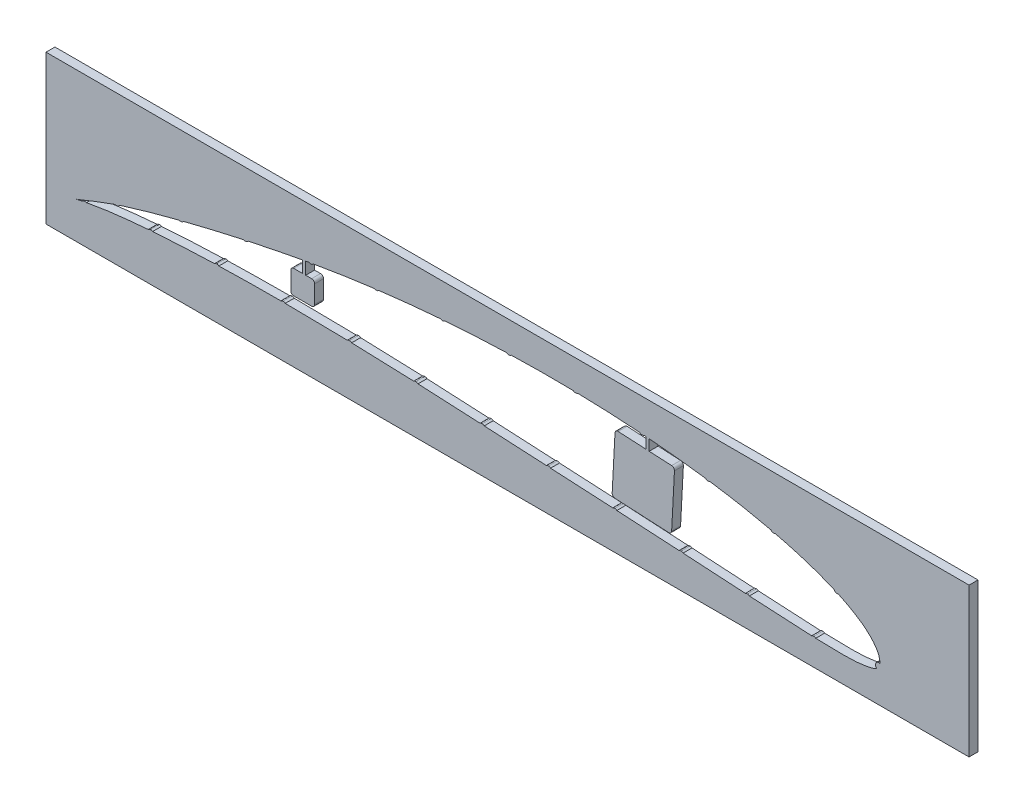
from build123d import *

# Parameters (mm, degrees)
SKETCH1_W           = 310
SKETCH1_H           = 50
BOSS_EXTRUDE1_DEPTH = 3
BOSS_EXTRUDE2_DEPTH = 3


with BuildPart() as part:
    # Sketch1 → Boss-Extrude1 (new body)
    with BuildSketch(Plane.XY):
        with Locations((-125.06174183, 12.712423786)):
            Rectangle(SKETCH1_W, SKETCH1_H)
        with BuildLine():
            Line((-190.854046013, 16.427278573), (-192.854046013, 16.427278573))
            Line((-192.854046013, 16.427278573), (-192.854046013, 20.54514466))
            add(Edge.make_bspline(
                [(-78.484522378, 26.652149662), (-81.251127261, 26.869634885), (-87.073414981, 27.26302757), (-96.025885422, 27.668047953), (-105.384918155, 27.886864858), (-114.898008488, 27.902696712), (-124.515804536, 27.706451524), (-134.190671536, 27.317931762), (-143.873797479, 26.720630751), (-153.514388277, 25.926027355), (-163.067203005, 24.949636107), (-172.485706502, 23.778880627), (-181.729078705, 22.446563535), (-188.496197907, 21.326847294), (-192.17762913, 20.66781533), (-192.854046013, 20.54514466)],
                knots=[1.647759632, 1.647759632, 1.647759632, 1.647759632, 1.66281273, 1.679411487, 1.69636694, 1.713589801, 1.731010056, 1.748544795, 1.766108786, 1.783630907, 1.801013171, 1.818193169, 1.835110052, 1.851667835, 1.855396799, 1.855396799, 1.855396799, 1.855396799], degree=3))
            Line((-78.484522378, 26.652149662), (-78.484522378, 22.972101896))
            Line((-78.484522378, 22.972101896), (-87.927242035, 23.466973864))
            ThreePointArc((-87.927242035, 23.466973864), (-88.648708598, 23.211489154), (-88.978207526, 22.520680285))
            Line((-88.978207526, 22.520680285), (-89.920254739, 4.54534866))
            ThreePointArc((-89.920254739, 4.54534866), (-89.66477003, 3.823882097), (-88.97396116, 3.494383169))
            Line((-88.97396116, 3.494383169), (-70.998629535, 2.552335956))
            ThreePointArc((-70.998629535, 2.552335956), (-70.277162972, 2.807820666), (-69.947664044, 3.498629535))
            Line((-69.947664044, 3.498629535), (-69.005616831, 21.47396116))
            ThreePointArc((-69.005616831, 21.47396116), (-69.261101541, 22.195427723), (-69.95191041, 22.524926651))
            Line((-69.95191041, 22.524926651), (-77.484522378, 22.919694117))
            Line((-77.484522378, 22.919694117), (-77.484522378, 26.572204531))
            add(Edge.make_bspline(
                [(-193.854046013, 20.362650577), (-195.775064558, 20.009909173), (-200.53741142, 19.104785804), (-208.019279368, 17.586839989), (-216.168249336, 15.817671132), (-223.918686457, 14.035986434), (-231.212223769, 12.266490942), (-237.993728291, 10.535115835), (-244.210175447, 8.86000319), (-249.810113571, 7.265271836), (-254.761430832, 5.754227714), (-259.022541081, 4.299422433), (-262.648403106, 2.919508457), (-265.493337403, 1.754738112), (-267.906768705, 0.800062229), (-268.932933558, 0.352495646), (-270.280471496, -0.080567148), (-268.860809828, 0.278822671), (-267.668480022, 0.489833575), (-264.748869214, 1.083641172), (-261.088929812, 1.667980045), (-256.238976815, 2.310371582), (-250.459331692, 2.918267219), (-243.743065142, 3.484691083), (-236.181287302, 3.97467364), (-227.838646738, 4.368141791), (-218.796298238, 4.649921554), (-209.136302534, 4.808551014), (-198.94497761, 4.83921239), (-188.310538638, 4.740747809), (-177.32201621, 4.516393994), (-166.072995783, 4.174175733), (-154.665861127, 3.704101734), (-143.201063086, 3.137782813), (-131.757912783, 2.542116383), (-120.393777003, 1.94386939), (-109.157898555, 1.367589163), (-98.110689784, 0.793603648), (-87.325082432, 0.209915111), (-76.878076189, -0.378270295), (-66.846774726, -0.96142336), (-57.305003865, -1.531721296), (-48.322523014, -2.071535165), (-39.965688156, -2.570181112), (-32.295387746, -3.004453917), (-25.368431611, -3.360900663), (-19.237427863, -3.615179778), (-13.940140176, -3.732291891), (-9.503770594, -3.670988449), (-5.900938941, -3.41461399), (-3.191596638, -2.861610206), (-1.170171151, -2.329008204), (0.014220637, -1.034555315), (0.028186054, 0.614855639), (-0.371136915, 2.38878086), (-1.478979381, 4.293083172), (-3.162430323, 6.261264624), (-5.472242964, 8.274548329), (-8.419068717, 10.259041262), (-11.975730704, 12.243103476), (-16.161330709, 14.167604478), (-20.956808743, 16.015791751), (-26.337844602, 17.793495066), (-32.285460779, 19.468254867), (-38.767317027, 21.03094444), (-45.75223324, 22.464443982), (-53.204283366, 23.7510727), (-61.083945503, 24.88718815), (-69.222973825, 25.839585804), (-74.735956271, 26.348793209), (-77.484522378, 26.572204531)],
                knots=[0.857234774, 0.857234774, 0.857234774, 0.857234774, 0.867829233, 0.883529135, 0.898644977, 0.913060925, 0.926666149, 0.939354581, 0.951026028, 0.961586441, 0.970943402, 0.979085416, 0.986060364, 0.991821214, 0.996214085, 0.999021075, 1, 1.000988678, 1.003950606, 1.008892929, 1.015820808, 1.024635018, 1.035203508, 1.047420673, 1.06116749, 1.076313586, 1.092720066, 1.110239434, 1.128718328, 1.148000656, 1.167925959, 1.188335797, 1.209046907, 1.229854233, 1.250600951, 1.271203147, 1.291583147, 1.311628914, 1.331208392, 1.350174108, 1.368387322, 1.385713984, 1.402024798, 1.417199794, 1.431125285, 1.443698357, 1.454822889, 1.46441268, 1.472428608, 1.478904988, 1.483926315, 1.487499338, 1.490013233, 1.492769992, 1.496008152, 1.499868297, 1.504543556, 1.510029863, 1.516427009, 1.523784407, 1.532099009, 1.541394321, 1.551648505, 1.562828637, 1.574901531, 1.587808503, 1.601500251, 1.615916545, 1.630987665, 1.645945774, 1.645945774, 1.645945774, 1.645945774], degree=3))
            Line((-193.854046013, 20.362650577), (-193.854046013, 16.427278573))
            Line((-193.854046013, 16.427278573), (-196.854046013, 16.427278573))
            ThreePointArc((-196.854046013, 16.427278573), (-197.561152794, 16.134385355), (-197.854046013, 15.427278573))
            Line((-197.854046013, 15.427278573), (-197.854046013, 9.427278573))
            ThreePointArc((-197.854046013, 9.427278573), (-197.561152794, 8.720171792), (-196.854046013, 8.427278573))
            Line((-196.854046013, 8.427278573), (-190.854046013, 8.427278573))
            ThreePointArc((-190.854046013, 8.427278573), (-190.146939231, 8.720171792), (-189.854046013, 9.427278573))
            Line((-189.854046013, 9.427278573), (-189.854046013, 15.427278573))
            ThreePointArc((-189.854046013, 15.427278573), (-190.146939231, 16.134385355), (-190.854046013, 16.427278573))
        make_face(mode=Mode.SUBTRACT)
    extrude(amount=BOSS_EXTRUDE1_DEPTH)

    # Sketch3 → Boss-Extrude2 (add)
    with BuildSketch(Plane.XY.offset(3)):
        with BuildLine():
            add(Edge.make_bspline(
                [(-267.793762898, 0.47434084), (-267.390184569, 0.551157346), (-266.937861366, 0.640531573), (-266.468076613, 0.732523454)],
                knots=[1.004098785, 1.004098785, 1.004098785, 1.004098785, 1.00662261, 1.00662261, 1.00662261, 1.00662261], degree=3))
            add(Edge.make_bspline(
                [(-266.468076613, 0.732523454), (-266.478840093, 0.737579212), (-266.558089384, 0.773578021), (-266.711434593, 0.827459912), (-266.940755908, 0.8496544), (-267.092205745, 0.827711349), (-267.169404391, 0.8165263)],
                knots=[4.868465908, 4.868465908, 4.868465908, 4.868465908, 5.023571471, 6.003525842, 6.98233563, 8, 8, 8, 8], degree=3))
            add(Edge.make_bspline(
                [(-267.169404391, 0.8165263), (-267.245256457, 0.797530584), (-267.394244651, 0.760219307), (-267.597057236, 0.652197292), (-267.724242813, 0.548239461), (-267.784693534, 0.484296393), (-267.793762906, 0.474340855)],
                knots=[0, 0, 0, 0, 1.018964881, 2.001445009, 2.97537636, 3.151369878, 3.151369878, 3.151369878, 3.151369878], degree=3))
        make_face()
        with BuildLine():
            add(Edge.make_bspline(
                [(-245.023955545, 3.619065333), (-245.101278068, 3.609497866), (-245.25407744, 3.590591305), (-245.467040718, 3.501915976), (-245.620876919, 3.401767636), (-245.700896803, 3.330757778), (-245.72395492, 3.308593067)],
                knots=[0, 0, 0, 0, 1.012815776, 2.001455852, 2.978964713, 3.395872817, 3.395872817, 3.395872817, 3.395872817], degree=3))
            add(Edge.make_bspline(
                [(-245.723954917, 3.308593059), (-245.243381938, 3.34699133), (-244.762718726, 3.384401488), (-244.282020378, 3.420861121)],
                knots=[1.04433834, 1.04433834, 1.04433834, 1.04433834, 1.046952468, 1.046952468, 1.046952468, 1.046952468], degree=3))
            add(Edge.make_bspline(
                [(-244.282020378, 3.42086112), (-244.308930616, 3.439511225), (-244.399897478, 3.49732505), (-244.567874863, 3.572679986), (-244.792114926, 3.626792939), (-244.945922061, 3.621666309), (-245.023955545, 3.619065333)],
                knots=[4.598240587, 4.598240587, 4.598240587, 4.598240587, 5.024581527, 6.00155117, 6.986094334, 8, 8, 8, 8], degree=3))
        make_face()
        with BuildLine():
            add(Edge.make_bspline(
                [(-255.359721414, 5.53183626), (-255.838491485, 5.374993967), (-256.316329294, 5.215676841), (-256.7934998, 5.053581901)],
                knots=[0.971696601, 0.971696601, 0.971696601, 0.971696601, 0.974432324, 0.974432324, 0.974432324, 0.974432324], degree=3))
            add(Edge.make_bspline(
                [(-256.7934998, 5.053581901), (-256.749823745, 5.034625842), (-256.635403496, 4.992494459), (-256.441215659, 4.957813802), (-256.21292918, 4.96109392), (-256.066209624, 5.00253306), (-255.991393854, 5.023663857)],
                knots=[4.403727713, 4.403727713, 4.403727713, 4.403727713, 5.028536856, 6.002664276, 6.981511295, 8, 8, 8, 8], degree=3))
            add(Edge.make_bspline(
                [(-255.991393854, 5.023663857), (-255.91927165, 5.051054782), (-255.776957192, 5.105103666), (-255.592038558, 5.238874738), (-255.455354732, 5.385159708), (-255.385442524, 5.488486224), (-255.359721414, 5.53183626)],
                knots=[0, 0, 0, 0, 1.009161318, 1.991318031, 2.963919563, 3.624554738, 3.624554738, 3.624554738, 3.624554738], degree=3))
        make_face()
        with BuildLine():
            add(Edge.make_bspline(
                [(-222.747114127, 4.780986188), (-222.824891728, 4.774977505), (-222.977324444, 4.763201364), (-223.194848818, 4.687135569), (-223.355215687, 4.592047239), (-223.441146032, 4.521885412), (-223.467342742, 4.498540326)],
                knots=[0, 0, 0, 0, 1.016117046, 1.99144072, 2.980674945, 3.438668867, 3.438668867, 3.438668867, 3.438668867], degree=3))
            add(Edge.make_bspline(
                [(-223.46734274, 4.498540319), (-222.980243182, 4.513806768), (-222.493125643, 4.528468294), (-222.005991475, 4.542539833)],
                knots=[1.08464095, 1.08464095, 1.08464095, 1.08464095, 1.087284453, 1.087284453, 1.087284453, 1.087284453], degree=3))
            add(Edge.make_bspline(
                [(-222.005991473, 4.54253984), (-222.034933517, 4.565524614), (-222.126392065, 4.6316989), (-222.294254047, 4.716248), (-222.516130475, 4.777410815), (-222.668699075, 4.779772409), (-222.747114127, 4.780986188)],
                knots=[4.538777728, 4.538777728, 4.538777728, 4.538777728, 5.021253167, 6.012496999, 6.978491293, 8, 8, 8, 8], degree=3))
        make_face()
        with BuildLine():
            add(Edge.make_bspline(
                [(-233.929945547, 11.568361966), (-234.410811339, 11.446245271), (-234.891517309, 11.323496699), (-235.372056491, 11.200092009)],
                knots=[0.931434005, 0.931434005, 0.931434005, 0.931434005, 0.934125206, 0.934125206, 0.934125206, 0.934125206], degree=3))
            add(Edge.make_bspline(
                [(-235.372056491, 11.200092009), (-235.335050993, 11.18211839), (-235.228329461, 11.136453299), (-235.042669743, 11.086099768), (-234.811818713, 11.073640251), (-234.660587884, 11.104611041), (-234.583576876, 11.120382242)],
                knots=[4.487628115, 4.487628115, 4.487628115, 4.487628115, 5.022708447, 5.995940444, 6.97947629, 8, 8, 8, 8], degree=3))
            add(Edge.make_bspline(
                [(-234.583576876, 11.120382242), (-234.509083118, 11.143197524), (-234.362719314, 11.188024521), (-234.167858574, 11.310470645), (-234.02627362, 11.441614449), (-233.953980395, 11.534080051), (-233.929945556, 11.568361977)],
                knots=[0, 0, 0, 0, 1.012744823, 1.989820203, 2.972059704, 3.517376857, 3.517376857, 3.517376857, 3.517376857], degree=3))
        make_face()
        with BuildLine():
            add(Edge.make_bspline(
                [(-200.440005643, 5.082888308), (-200.518070257, 5.078791089), (-200.670472831, 5.070792243), (-200.890089113, 5.004091604), (-201.052844639, 4.912657476), (-201.141750556, 4.845249392), (-201.169809362, 4.821976337)],
                knots=[0, 0, 0, 0, 1.020257774, 1.99181043, 2.972259712, 3.448713741, 3.448713741, 3.448713741, 3.448713741], degree=3))
            add(Edge.make_bspline(
                [(-201.169809361, 4.821976331), (-200.681955226, 4.821723352), (-200.194101339, 4.821038459), (-199.706248513, 4.819930467)],
                knots=[1.124963496, 1.124963496, 1.124963496, 1.124963496, 1.127609793, 1.127609793, 1.127609793, 1.127609793], degree=3))
            add(Edge.make_bspline(
                [(-199.706248511, 4.819930473), (-199.734836026, 4.844094211), (-199.824344963, 4.912797485), (-199.99061139, 5.000750461), (-200.209411191, 5.070098289), (-200.361897922, 5.07855603), (-200.440005643, 5.082888308)],
                knots=[4.53221387, 4.53221387, 4.53221387, 4.53221387, 5.021571255, 6.007323212, 6.979298455, 8, 8, 8, 8], degree=3))
        make_face()
        with BuildLine():
            add(Edge.make_bspline(
                [(-212.221115848, 16.670006776), (-212.707711775, 16.56441245), (-213.194186025, 16.458256935), (-213.680538792, 16.351547529)],
                knots=[0.891110453, 0.891110453, 0.891110453, 0.891110453, 0.893811356, 0.893811356, 0.893811356, 0.893811356], degree=3))
            add(Edge.make_bspline(
                [(-213.680538792, 16.351547529), (-213.644033487, 16.331597971), (-213.538733114, 16.281210173), (-213.352575734, 16.23101408), (-213.123054159, 16.205443019), (-212.970920786, 16.232236484), (-212.893377202, 16.245893325)],
                knots=[4.486145224, 4.486145224, 4.486145224, 4.486145224, 5.02598796, 6.000604059, 6.980892074, 8, 8, 8, 8], degree=3))
            add(Edge.make_bspline(
                [(-212.893377202, 16.245893325), (-212.817802933, 16.266661813), (-212.669705883, 16.307360213), (-212.467467289, 16.419940996), (-212.321640611, 16.547218953), (-212.246100292, 16.637149657), (-212.221115848, 16.670006776)],
                knots=[0, 0, 0, 0, 1.016905749, 1.992751556, 2.981924989, 3.518295554, 3.518295554, 3.518295554, 3.518295554], degree=3))
        make_face()
        with BuildLine():
            add(Edge.make_bspline(
                [(-178.132477236, 4.776871171), (-178.210725093, 4.774226807), (-178.363569747, 4.769061465), (-178.586543449, 4.711919716), (-178.749952355, 4.622802077), (-178.839186711, 4.557840097), (-178.866774155, 4.536021099)],
                knots=[0, 0, 0, 0, 1.022532339, 1.997353114, 2.979055603, 3.438781285, 3.438781285, 3.438781285, 3.438781285], degree=3))
            add(Edge.make_bspline(
                [(-178.866774154, 4.536021095), (-178.381769609, 4.524361273), (-177.894511356, 4.512323019), (-177.407261197, 4.499965432), (-177.40499983, 4.499908073)],
                knots=[1.165294356, 1.165294356, 1.165294356, 1.165294356, 1.167925959, 1.16793823, 1.16793823, 1.16793823, 1.16793823], degree=3))
            add(Edge.make_bspline(
                [(-177.404999828, 4.49990808), (-177.432667302, 4.524133376), (-177.5207516, 4.594369534), (-177.683618363, 4.688451771), (-177.902075531, 4.761858796), (-178.054634974, 4.771799172), (-178.132477236, 4.776871171)],
                knots=[4.53621722, 4.53621722, 4.53621722, 4.53621722, 5.016588222, 6.006730755, 6.982949963, 8, 8, 8, 8], degree=3))
        make_face()
        with BuildLine():
            add(Edge.make_bspline(
                [(-155.836828262, 4.00154749), (-155.915467408, 4.001895511), (-156.068975788, 4.002574869), (-156.290315365, 3.939922426), (-156.460362888, 3.860978819), (-156.551976544, 3.796534492), (-156.581085876, 3.773888242)],
                knots=[0, 0, 0, 0, 1.023444484, 1.997825661, 2.978931005, 3.460338685, 3.460338685, 3.460338685, 3.460338685], degree=3))
            add(Edge.make_bspline(
                [(-156.581085873, 3.773888232), (-156.094143326, 3.752510867), (-155.607212692, 3.730866238), (-155.120293937, 3.708965076)],
                knots=[1.205613891, 1.205613891, 1.205613891, 1.205613891, 1.208257794, 1.208257794, 1.208257794, 1.208257794], degree=3))
            add(Edge.make_bspline(
                [(-155.120293934, 3.708965083), (-155.146167781, 3.732513848), (-155.230792853, 3.803366073), (-155.389439283, 3.901676855), (-155.60647794, 3.979826963), (-155.759244034, 3.994231805), (-155.836828262, 4.00154749)],
                knots=[4.558911359, 4.558911359, 4.558911359, 4.558911359, 5.015852811, 5.999881644, 6.984214142, 8, 8, 8, 8], degree=3))
        make_face()
        with BuildLine():
            add(Edge.make_bspline(
                [(-133.558549949, 2.874865269), (-133.637173707, 2.876459349), (-133.790652048, 2.879571089), (-134.012956615, 2.820433819), (-134.176929887, 2.747445759), (-134.263643196, 2.69007374), (-134.28709691, 2.673185916)],
                knots=[0, 0, 0, 0, 1.023444484, 1.997825661, 2.978931005, 3.356421378, 3.356421378, 3.356421378, 3.356421378], degree=3))
            add(Edge.make_bspline(
                [(-134.287096906, 2.673185899), (-133.817491971, 2.648688123), (-133.34788861, 2.624160078), (-132.878286437, 2.59960907)],
                knots=[1.245973539, 1.245973539, 1.245973539, 1.245973539, 1.248524327, 1.248524327, 1.248524327, 1.248524327], degree=3))
            add(Edge.make_bspline(
                [(-132.878286434, 2.599609079), (-132.893903423, 2.613306858), (-132.967747207, 2.674818051), (-133.112799673, 2.767917926), (-133.328572728, 2.849497379), (-133.481091385, 2.866321117), (-133.558549949, 2.874865269)],
                knots=[4.744454359, 4.744454359, 4.744454359, 4.744454359, 5.015852811, 5.999881644, 6.984214142, 8, 8, 8, 8], degree=3))
        make_face()
        with BuildLine():
            add(Edge.make_bspline(
                [(-111.28636729, 1.718143076), (-111.364993141, 1.719630397), (-111.518475566, 1.72253374), (-111.74069963, 1.663094677), (-111.90546688, 1.589484988), (-111.992830014, 1.531316826), (-112.017005475, 1.513761561)],
                knots=[0, 0, 0, 0, 1.023444484, 1.997825661, 2.978931005, 3.369137804, 3.369137804, 3.369137804, 3.369137804], degree=3))
            add(Edge.make_bspline(
                [(-112.017005471, 1.513761545), (-111.545459671, 1.489467808), (-111.073914091, 1.465169653), (-110.602369117, 1.440859575)],
                knots=[1.286295342, 1.286295342, 1.286295342, 1.286295342, 1.288856585, 1.288856585, 1.288856585, 1.288856585], degree=3))
            add(Edge.make_bspline(
                [(-110.602369114, 1.440859583), (-110.619073756, 1.45557929), (-110.69403076, 1.51809021), (-110.840472211, 1.611801077), (-111.056355837, 1.693087475), (-111.208897197, 1.709704106), (-111.28636729, 1.718143076)],
                knots=[4.724973811, 4.724973811, 4.724973811, 4.724973811, 5.015852811, 5.999881644, 6.984214142, 8, 8, 8, 8], degree=3))
        make_face()
        with BuildLine():
            add(Edge.make_bspline(
                [(-89.013915983, 0.530722938), (-89.09253043, 0.532724238), (-89.245990594, 0.536630895), (-89.468598487, 0.478645872), (-89.629921484, 0.407836367), (-89.714446036, 0.353170664), (-89.735436554, 0.338506392)],
                knots=[0, 0, 0, 0, 1.023444484, 1.997825661, 2.978931005, 3.313464767, 3.313464767, 3.313464767, 3.313464767], degree=3))
            add(Edge.make_bspline(
                [(-89.735436549, 0.338506372), (-89.272612117, 0.313184626), (-88.809791252, 0.287797714), (-88.346973994, 0.262345318)],
                knots=[1.326639378, 1.326639378, 1.326639378, 1.326639378, 1.329153675, 1.329153675, 1.329153675, 1.329153675], degree=3))
            add(Edge.make_bspline(
                [(-88.346973991, 0.262345327), (-88.358712039, 0.2724794), (-88.428596911, 0.330500328), (-88.568725633, 0.421468214), (-88.784073243, 0.504164194), (-88.936502713, 0.521777695), (-89.013915983, 0.530722938)],
                knots=[4.813235575, 4.813235575, 4.813235575, 4.813235575, 5.015852811, 5.999881644, 6.984214142, 8, 8, 8, 8], degree=3))
        make_face()
        with BuildLine():
            add(Edge.make_bspline(
                [(-66.746335218, -0.750164769), (-66.824930618, -0.747519106), (-66.978353603, -0.742354612), (-67.201429341, -0.798512889), (-67.358760543, -0.866037565), (-67.439933886, -0.916702578), (-67.457122844, -0.928152382)],
                knots=[0, 0, 0, 0, 1.023444484, 1.997825661, 2.978931005, 3.248867788, 3.248867788, 3.248867788, 3.248867788], degree=3))
            add(Edge.make_bspline(
                [(-67.457122837, -0.9281524), (-67.199340042, -0.94332087), (-66.746976527, -0.969968184), (-66.294616023, -0.996666482), (-66.100036149, -1.008159588)],
                knots=[1.366986587, 1.366986587, 1.366986587, 1.366986587, 1.368387322, 1.36944464, 1.36944464, 1.36944464, 1.36944464], degree=3))
            add(Edge.make_bspline(
                [(-66.100036145, -1.008159577), (-66.105702389, -1.003386618), (-66.169470541, -0.950689024), (-66.302055427, -0.863065208), (-66.516717912, -0.778606725), (-66.668997877, -0.759744296), (-66.746335218, -0.750164769)],
                knots=[4.91905114, 4.91905114, 4.91905114, 4.91905114, 5.015852811, 5.999881644, 6.984214142, 8, 8, 8, 8], degree=3))
        make_face()
        with BuildLine():
            add(Edge.make_bspline(
                [(-44.4832946, -2.080833445), (-44.561886955, -2.078098808), (-44.715303995, -2.072760632), (-44.938443165, -2.128666337), (-45.095764593, -2.195976016), (-45.176923244, -2.246487525), (-45.194050488, -2.257861654)],
                knots=[0, 0, 0, 0, 1.023444484, 1.997825661, 2.978931005, 3.247650293, 3.247650293, 3.247650293, 3.247650293], degree=3))
            add(Edge.make_bspline(
                [(-45.194050481, -2.257861672), (-44.742247225, -2.284772574), (-44.290441054, -2.311633305), (-43.838631081, -2.338427529)],
                knots=[1.407312893, 1.407312893, 1.407312893, 1.407312893, 1.409767994, 1.409767994, 1.409767994, 1.409767994], degree=3))
            add(Edge.make_bspline(
                [(-43.838631076, -2.338427517), (-43.843851063, -2.33403364), (-43.907148118, -2.281685446), (-44.039142904, -2.194236766), (-44.25370964, -2.109535324), (-44.405968154, -2.090500517), (-44.4832946, -2.080833445)],
                knots=[4.92670192, 4.92670192, 4.92670192, 4.92670192, 5.015852811, 5.999881644, 6.984214142, 8, 8, 8, 8], degree=3))
        make_face()
        with BuildLine():
            add(Edge.make_bspline(
                [(-190.318477623, 20.997367187), (-190.486986248, 20.967831044), (-190.976874583, 20.881660246), (-191.466610664, 20.794632211), (-191.787844235, 20.737178636)],
                knots=[1.850739854, 1.850739854, 1.850739854, 1.850739854, 1.851667835, 1.853437965, 1.853437965, 1.853437965, 1.853437965], degree=3))
            add(Edge.make_bspline(
                [(-191.787844233, 20.737178656), (-191.75110527, 20.715038262), (-191.646745179, 20.659412297), (-191.462648394, 20.599272449), (-191.23524863, 20.569470388), (-191.083902094, 20.588390634), (-191.006662718, 20.59804654)],
                knots=[4.459855766, 4.459855766, 4.459855766, 4.459855766, 5.021260958, 6.007166681, 6.982961853, 8, 8, 8, 8], degree=3))
            add(Edge.make_bspline(
                [(-191.006662718, 20.59804654), (-190.930318899, 20.61502714), (-190.780989743, 20.648241337), (-190.578903107, 20.756584459), (-190.425238304, 20.87503224), (-190.345916547, 20.963306178), (-190.318477623, 20.997367187)],
                knots=[0, 0, 0, 0, 1.021170718, 1.997418549, 2.978274246, 3.550681198, 3.550681198, 3.550681198, 3.550681198], degree=3))
        make_face()
        with BuildLine():
            add(Edge.make_bspline(
                [(-22.217960077, -3.267214361), (-22.296252592, -3.267258917), (-22.449184476, -3.26734595), (-22.673932697, -3.317051975), (-22.827386101, -3.394243051), (-22.907802807, -3.446836651), (-22.925028119, -3.45870522)],
                knots=[0, 0, 0, 0, 1.022532339, 1.997353114, 2.979055603, 3.252421047, 3.252421047, 3.252421047, 3.252421047], degree=3))
            add(Edge.make_bspline(
                [(-22.925028116, -3.458705234), (-22.470796534, -3.47783912), (-22.016533038, -3.496298379), (-21.562228809, -3.513955533)],
                knots=[1.447637274, 1.447637274, 1.447637274, 1.447637274, 1.450103464, 1.450103464, 1.450103464, 1.450103464], degree=3))
            add(Edge.make_bspline(
                [(-21.562228806, -3.513955524), (-21.569421034, -3.508116073), (-21.636076656, -3.45532642), (-21.772284859, -3.370490101), (-21.988183948, -3.289869327), (-22.140329169, -3.274868444), (-22.217960077, -3.267214361)],
                knots=[4.895513355, 4.895513355, 4.895513355, 4.895513355, 5.016588222, 6.006730755, 6.982949963, 8, 8, 8, 8], degree=3))
        make_face()
        with BuildLine():
            add(Edge.make_bspline(
                [(-168.270728441, 24.294466836), (-168.763835662, 24.232804738), (-169.256843874, 24.170347218), (-169.749751981, 24.107107066)],
                knots=[1.810428026, 1.810428026, 1.810428026, 1.810428026, 1.813123617, 1.813123617, 1.813123617, 1.813123617], degree=3))
            add(Edge.make_bspline(
                [(-169.749751981, 24.107107067), (-169.713581462, 24.083518574), (-169.612010463, 24.024224631), (-169.433544387, 23.950414122), (-169.207713679, 23.913582598), (-169.055664117, 23.924574838), (-168.978111101, 23.93018144)],
                knots=[4.473176521, 4.473176521, 4.473176521, 4.473176521, 5.037763237, 6.009376168, 6.984680534, 8, 8, 8, 8], degree=3))
            add(Edge.make_bspline(
                [(-168.978111101, 23.93018144), (-168.90142057, 23.943621025), (-168.750802004, 23.970016085), (-168.5400325, 24.063376381), (-168.383910535, 24.179231882), (-168.299624339, 24.262752316), (-168.270728441, 24.294466836)],
                knots=[0, 0, 0, 0, 1.014535394, 1.992525864, 2.979250261, 3.539122721, 3.539122721, 3.539122721, 3.539122721], degree=3))
        make_face()
        with BuildLine():
            add(Edge.make_bspline(
                [(-1.094853393, -2.042457656), (-1.08558231, -2.049667895), (-1.076311226, -2.056878134), (-1.067023803, -2.064063616)],
                knots=[0, 0, 0, 0, 0.153518616, 0.153518616, 0.153518616, 0.153518616], degree=3))
            add(Edge.make_bspline(
                [(-1.067023803, -2.064063616), (-0.685162089, -1.798907567), (-0.117697015, -1.174942823), (-0.004967279, -0.387772907), (-0.000379941, -0.055533361)],
                knots=[1.487523627, 1.487523627, 1.487523627, 1.487523627, 1.490013233, 1.491780179, 1.491780179, 1.491780179, 1.491780179], degree=3))
            add(Edge.make_bspline(
                [(-0.000379941, -0.055533361), (-0.059965889, -0.037742992), (-0.197310888, -0.008626495), (-0.415852362, -0.00292606), (-0.644937168, -0.035502421), (-0.859530243, -0.11435627), (-1.053932486, -0.235110991), (-1.160099866, -0.344444625), (-1.21393711, -0.399887469)],
                knots=[2.162846994, 2.162846994, 2.162846994, 2.162846994, 2.978493865, 4.000928984, 5.021145435, 6.002338952, 6.986990499, 8, 8, 8, 8], degree=3))
            add(Edge.make_bspline(
                [(-1.21393711, -0.399887469), (-1.261664594, -0.461027892), (-1.355790986, -0.58160679), (-1.450563582, -0.790717018), (-1.496268485, -1.014932751), (-1.50024499, -1.245689039), (-1.46494958, -1.474662886), (-1.382438701, -1.687841235), (-1.262702971, -1.883772324), (-1.151461036, -1.988940676), (-1.094853393, -2.042457656)],
                knots=[0, 0, 0, 0, 1.015222514, 2.00218458, 2.980032379, 3.998510717, 5.016989055, 5.998983224, 6.981743319, 8, 8, 8, 8], degree=3))
        make_face()
        with BuildLine():
            add(Edge.make_bspline(
                [(-146.092116035, 26.522102622), (-146.586925954, 26.484111532), (-147.081676219, 26.445345161), (-147.576365037, 26.40580899)],
                knots=[1.770121259, 1.770121259, 1.770121259, 1.770121259, 1.772813161, 1.772813161, 1.772813161, 1.772813161], degree=3))
            add(Edge.make_bspline(
                [(-147.576365041, 26.405808978), (-147.543039593, 26.381581938), (-147.445925694, 26.318479283), (-147.269516843, 26.242651122), (-147.046249053, 26.187413881), (-146.892380716, 26.192444249), (-146.814316182, 26.194996387)],
                knots=[4.496582767, 4.496582767, 4.496582767, 4.496582767, 5.032459209, 6.002386309, 6.986518038, 8, 8, 8, 8], degree=3))
            add(Edge.make_bspline(
                [(-146.814316182, 26.194996387), (-146.736938005, 26.204386597), (-146.584028654, 26.222942875), (-146.371898581, 26.312109155), (-146.207965863, 26.41412722), (-146.121599508, 26.492371664), (-146.092116035, 26.522102622)],
                knots=[0, 0, 0, 0, 1.012612701, 2.00105455, 2.973405823, 3.518673912, 3.518673912, 3.518673912, 3.518673912], degree=3))
        make_face()
        with BuildLine():
            add(Edge.make_bspline(
                [(-14.812686334, 13.17526158), (-14.740365459, 13.146706291), (-14.598166893, 13.090560384), (-14.370991964, 13.064880071), (-14.154884887, 13.079059682), (-14.018350756, 13.115940369), (-13.955561017, 13.138548707)],
                knots=[0, 0, 0, 0, 1.017497944, 2.000622187, 2.973259471, 3.847854106, 3.847854106, 3.847854106, 3.847854106], degree=3))
            add(Edge.make_bspline(
                [(-13.955561017, 13.138548707), (-14.434793386, 13.360137844), (-14.91674589, 13.575888091), (-15.400965464, 13.786385381)],
                knots=[1.52802877, 1.52802877, 1.52802877, 1.52802877, 1.530892122, 1.530892122, 1.530892122, 1.530892122], degree=3))
            add(Edge.make_bspline(
                [(-15.400965463, 13.786385381), (-15.377356451, 13.727733701), (-15.317186048, 13.603859425), (-15.188309095, 13.43443135), (-15.018358957, 13.281249354), (-14.882315907, 13.21114328), (-14.812686334, 13.17526158)],
                knots=[4.199145723, 4.199145723, 4.199145723, 4.199145723, 5.026777775, 5.998786963, 6.975738864, 8, 8, 8, 8], degree=3))
        make_face()
        with BuildLine():
            add(Edge.make_bspline(
                [(-123.812632823, 27.695435417), (-124.039673855, 27.688885968), (-124.53605593, 27.674218137), (-125.032415047, 27.658795417), (-125.301741012, 27.650202982)],
                knots=[1.72977801, 1.72977801, 1.72977801, 1.72977801, 1.731010056, 1.732471699, 1.732471699, 1.732471699, 1.732471699], degree=3))
            add(Edge.make_bspline(
                [(-125.301741012, 27.650202982), (-125.269250638, 27.623641118), (-125.175215288, 27.554594777), (-125.00300949, 27.470305499), (-124.783511852, 27.404406212), (-124.63045942, 27.402483517), (-124.55195106, 27.40149727)],
                knots=[4.483341512, 4.483341512, 4.483341512, 4.483341512, 5.031293301, 6.006726805, 6.977549031, 8, 8, 8, 8], degree=3))
            add(Edge.make_bspline(
                [(-124.55195106, 27.40149727), (-124.474135136, 27.407351354), (-124.321627312, 27.418824501), (-124.104849371, 27.495271288), (-123.936313129, 27.591346244), (-123.844523125, 27.666403764), (-123.812632823, 27.695435417)],
                knots=[0, 0, 0, 0, 1.015044803, 1.98933928, 2.972010026, 3.534115274, 3.534115274, 3.534115274, 3.534115274], degree=3))
        make_face()
        with BuildLine():
            add(Edge.make_bspline(
                [(-35.951989192, 20.049317642), (-35.875013566, 20.034807268), (-35.725298217, 20.006585016), (-35.496383941, 20.022781756), (-35.304444038, 20.073277658), (-35.191814342, 20.125189439), (-35.149348032, 20.148005782)],
                knots=[0, 0, 0, 0, 1.021315902, 1.986429638, 2.973923132, 3.603470044, 3.603470044, 3.603470044, 3.603470044], degree=3))
            add(Edge.make_bspline(
                [(-35.149348032, 20.148005782), (-35.640337662, 20.267442456), (-36.131821178, 20.384850145), (-36.623763347, 20.50030539)],
                knots=[1.568447149, 1.568447149, 1.568447149, 1.568447149, 1.571187997, 1.571187997, 1.571187997, 1.571187997], degree=3))
            add(Edge.make_bspline(
                [(-36.623763347, 20.50030539), (-36.596418589, 20.461012823), (-36.52078751, 20.364385952), (-36.374092227, 20.230358356), (-36.174728844, 20.115259299), (-36.02736312, 20.071631952), (-35.951989192, 20.049317642)],
                knots=[4.400143861, 4.400143861, 4.400143861, 4.400143861, 5.024198162, 5.99847909, 6.976271501, 8, 8, 8, 8], degree=3))
        make_face()
        with BuildLine():
            add(Edge.make_bspline(
                [(-101.511653365, 27.78697469), (-102.009036202, 27.797637929), (-102.506437592, 27.807440065), (-103.003854553, 27.816384335)],
                knots=[1.689451021, 1.689451021, 1.689451021, 1.689451021, 1.69214959, 1.69214959, 1.69214959, 1.69214959], degree=3))
            add(Edge.make_bspline(
                [(-103.003854544, 27.81638436), (-102.971864122, 27.788000863), (-102.879878434, 27.71442902), (-102.712002832, 27.618280729), (-102.494474729, 27.543919146), (-102.341616418, 27.53344992), (-102.263719796, 27.528114801)],
                knots=[4.467675114, 4.467675114, 4.467675114, 4.467675114, 5.025893716, 6.004337373, 6.983009968, 8, 8, 8, 8], degree=3))
            add(Edge.make_bspline(
                [(-102.263719796, 27.528114801), (-102.185470993, 27.531364656), (-102.032624492, 27.537712728), (-101.810970072, 27.597368499), (-101.64022189, 27.689067256), (-101.54521327, 27.759395464), (-101.511653367, 27.786974696)],
                knots=[0, 0, 0, 0, 1.022262743, 1.996826501, 2.972080434, 3.539560867, 3.539560867, 3.539560867, 3.539560867], degree=3))
        make_face()
        with BuildLine():
            add(Edge.make_bspline(
                [(-57.850733582, 24.129151385), (-57.772765184, 24.12272216), (-57.619541364, 24.11008742), (-57.391484407, 24.146949605), (-57.206628094, 24.214819666), (-57.101012738, 24.273962839), (-57.062973087, 24.298277012)],
                knots=[0, 0, 0, 0, 1.017348339, 1.999297162, 2.98457156, 3.572328307, 3.572328307, 3.572328307, 3.572328307], degree=3))
            add(Edge.make_bspline(
                [(-57.062973083, 24.298276989), (-57.558474886, 24.369794061), (-58.054160476, 24.440037606), (-58.550020439, 24.509027549)],
                knots=[1.608787721, 1.608787721, 1.608787721, 1.608787721, 1.611503288, 1.611503288, 1.611503288, 1.611503288], degree=3))
            add(Edge.make_bspline(
                [(-58.550020438, 24.509027551), (-58.520734975, 24.475745019), (-58.437663797, 24.390635299), (-58.285165258, 24.270028039), (-58.077024518, 24.173681525), (-57.927141684, 24.144187177), (-57.850733582, 24.129151385)],
                knots=[4.45756754, 4.45756754, 4.45756754, 4.45756754, 5.036476226, 6.007845143, 6.984428265, 8, 8, 8, 8], degree=3))
        make_face()
        with BuildLine():
            add(Edge.make_bspline(
                [(-79.238364748, 26.710653997), (-79.73627066, 26.748796955), (-80.23425148, 26.785958918), (-80.732303016, 26.822146115)],
                knots=[1.649126745, 1.649126745, 1.649126745, 1.649126745, 1.651835434, 1.651835434, 1.651835434, 1.651835434], degree=3))
            add(Edge.make_bspline(
                [(-80.732303016, 26.822146115), (-80.701866488, 26.791749397), (-80.614618295, 26.713320304), (-80.452640852, 26.607122775), (-80.239525705, 26.520702076), (-80.086657601, 26.502717973), (-80.009300297, 26.493617307)],
                knots=[4.470650638, 4.470650638, 4.470650638, 4.470650638, 5.031288092, 5.997969198, 6.986893277, 8, 8, 8, 8], degree=3))
            add(Edge.make_bspline(
                [(-80.009300297, 26.493617307), (-79.931270714, 26.491706911), (-79.777814608, 26.48794985), (-79.553706129, 26.540754553), (-79.373694422, 26.617860595), (-79.273882029, 26.68409225), (-79.238364744, 26.710653986)],
                knots=[0, 0, 0, 0, 1.012745708, 1.991706309, 2.971196672, 3.547519985, 3.547519985, 3.547519985, 3.547519985], degree=3))
        make_face()
    extrude(amount=-BOSS_EXTRUDE2_DEPTH)


solid = part.part
